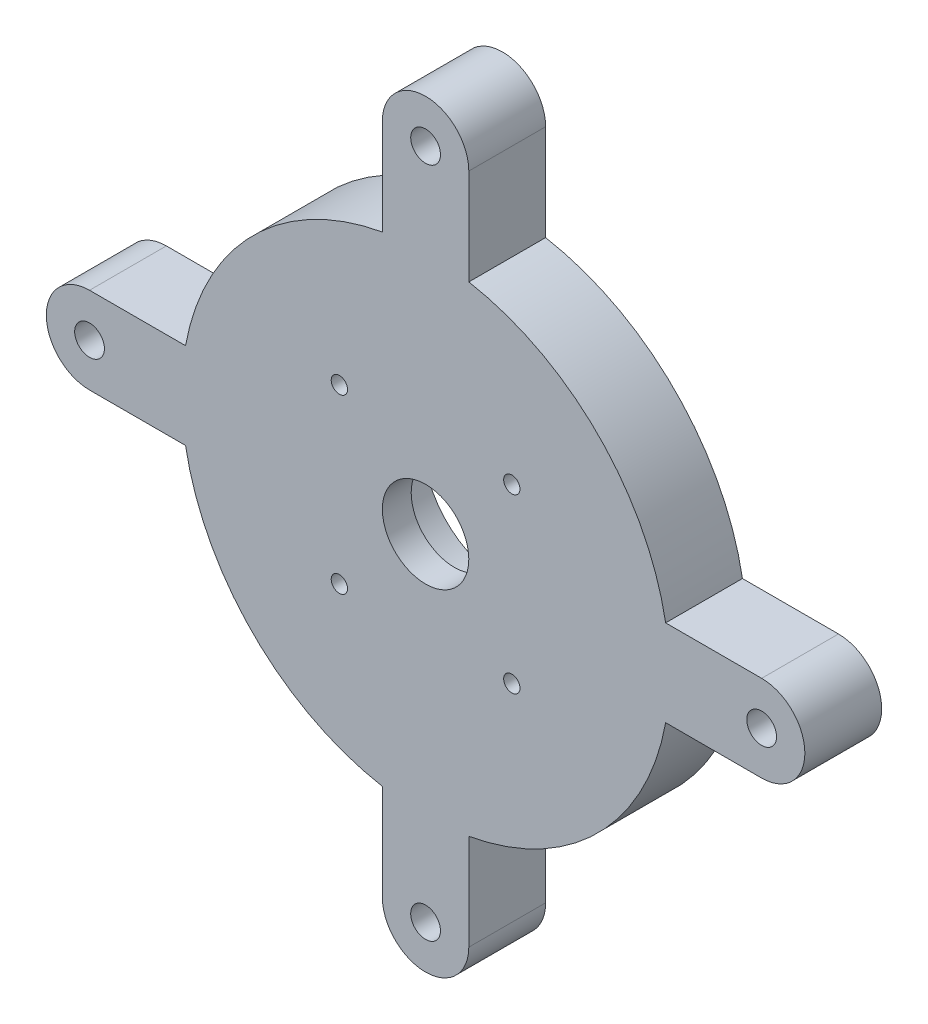
from build123d import *

# Parameters (mm, degrees)
SKETCH1_R           = 4.5
SKETCH1_R_2         = 0.85
SKETCH1_R_3         = 1.55
BOSS_EXTRUDE2_DEPTH = 8
SKETCH5_R           = 8.2
CUT_EXTRUDE3_DEPTH  = 5
SKETCH6_R           = 3.5
CUT_EXTRUDE6_DEPTH  = 2


with BuildPart() as part:
    # Sketch1 → Boss-Extrude2 (new body)
    with BuildSketch(Plane.XY):
        with BuildLine():
            Line((-35, 4.5), (-25, 4.5))
            ThreePointArc((-25, 4.5), (-17.961764947, 17.961764947), (-4.5, 25))
            Line((-4.5, 25), (-4.5, 35))
            ThreePointArc((-4.5, 35), (0, 39.5), (4.5, 35))
            Line((4.5, 35), (4.5, 25))
            ThreePointArc((4.5, 25), (17.961764947, 17.961764947), (25, 4.5))
            Line((25, 4.5), (35, 4.5))
            ThreePointArc((35, 4.5), (39.5, 0), (35, -4.5))
            Line((35, -4.5), (25, -4.5))
            ThreePointArc((25, -4.5), (17.961764947, -17.961764947), (4.5, -25))
            Line((4.5, -25), (4.5, -35))
            ThreePointArc((4.5, -35), (0, -39.5), (-4.5, -35))
            Line((-4.5, -35), (-4.5, -25))
            ThreePointArc((-4.5, -25), (-17.961764947, -17.961764947), (-25, -4.5))
            Line((-25, -4.5), (-35, -4.5))
            ThreePointArc((-35, -4.5), (-39.5, 0), (-35, 4.5))
        make_face()
        Circle(SKETCH1_R, mode=Mode.SUBTRACT)
        with Locations((8.980256121, 8.980256121)):
            Circle(SKETCH1_R_2, mode=Mode.SUBTRACT)
        with Locations((8.980256121, -8.980256121)):
            Circle(SKETCH1_R_2, mode=Mode.SUBTRACT)
        with Locations((-8.980256121, -8.980256121)):
            Circle(SKETCH1_R_2, mode=Mode.SUBTRACT)
        with Locations((-8.980256121, 8.980256121)):
            Circle(SKETCH1_R_2, mode=Mode.SUBTRACT)
        with Locations((-35, 0)):
            Circle(SKETCH1_R_3, mode=Mode.SUBTRACT)
        with Locations((0, 35)):
            Circle(SKETCH1_R_3, mode=Mode.SUBTRACT)
        with Locations((35, 0)):
            Circle(SKETCH1_R_3, mode=Mode.SUBTRACT)
        with Locations((0, -35)):
            Circle(SKETCH1_R_3, mode=Mode.SUBTRACT)
    extrude(amount=BOSS_EXTRUDE2_DEPTH)

    # Sketch5 → Cut-Extrude3 (cut)
    with BuildSketch(Plane(origin=(0, 0, 0), x_dir=(-1, 0, 0), z_dir=(0, 0, -1))):
        Circle(SKETCH5_R)
    extrude(amount=-CUT_EXTRUDE3_DEPTH, mode=Mode.SUBTRACT)

    # Sketch6 → Cut-Extrude6 (cut)
    with BuildSketch(Plane.XY):
        with Locations((0, 35)):
            Circle(SKETCH6_R)
        with Locations((35, 0)):
            Circle(SKETCH6_R)
        with Locations((0, -35)):
            Circle(SKETCH6_R)
        with Locations((-35, 0)):
            Circle(SKETCH6_R)
    extrude(amount=CUT_EXTRUDE6_DEPTH, mode=Mode.SUBTRACT)


solid = part.part
